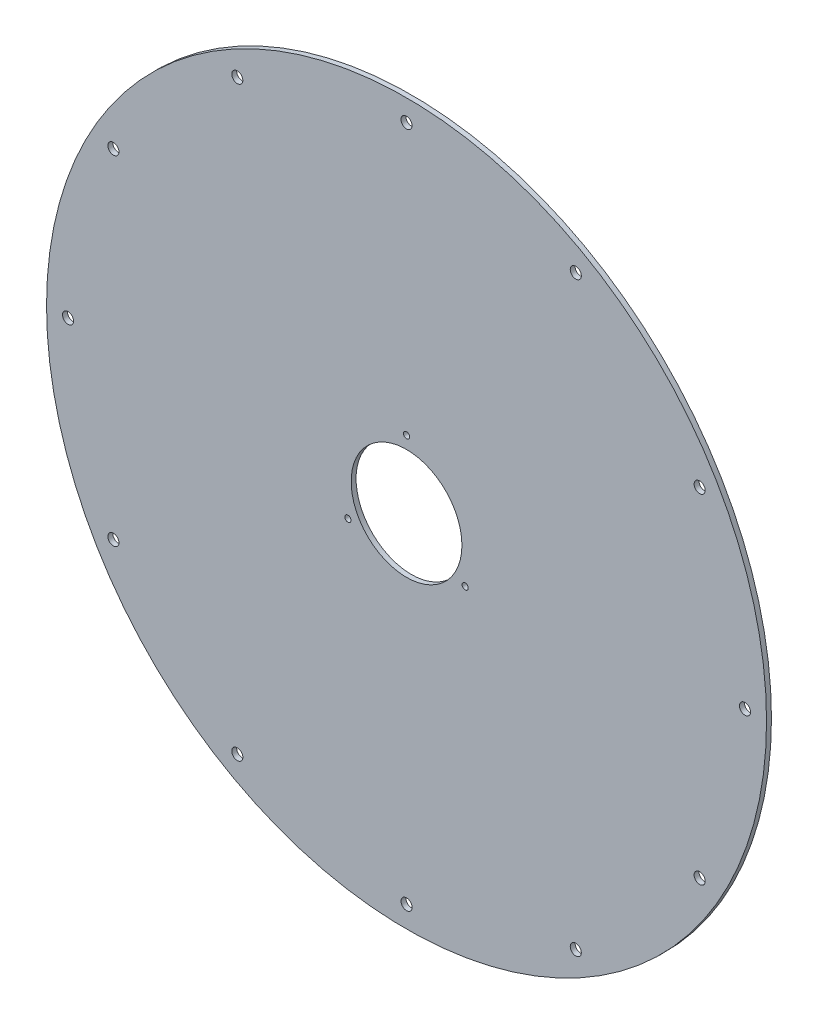
from build123d import *

# Parameters (mm, degrees)
SKETCH1_R           = 292.5
SKETCH1_R_2         = 45
BOSS_EXTRUDE1_DEPTH = 4
SKETCH2_R           = 4.5
CUT_EXTRUDE1_DEPTH  = 414.676806215
CIRPATTERN1_COUNT   = 12
CIRPATTERN3_COUNT   = 3


with BuildPart() as part:
    # Sketch1 → Boss-Extrude1 (new body)
    with BuildSketch(Plane.XY):
        Circle(SKETCH1_R)
        Circle(SKETCH1_R_2, mode=Mode.SUBTRACT)
    extrude(amount=BOSS_EXTRUDE1_DEPTH)

    # Sketch2 → Cut-Extrude1 (cut, through all)
    with BuildSketch(Plane.XY.offset(4)):
        with Locations((0, 275)):
            Circle(SKETCH2_R)
    cut_extrude1 = extrude(amount=-CUT_EXTRUDE1_DEPTH, mode=Mode.SUBTRACT)

    # CirPattern1: Cut-Extrude1 ×12 about axis
    cirpattern1_axis = Axis((0, 0, 0), (0, 0, 1))
    for i in range(1, CIRPATTERN1_COUNT):
        add(cut_extrude1.rotate(cirpattern1_axis, i * 360 / CIRPATTERN1_COUNT), mode=Mode.SUBTRACT)

    # Sketch6 → M6x1.0 Tapped Hole1 (revolve, cut)
    with BuildSketch(Plane(origin=(0, 55, 0), x_dir=(0, 1, 0), z_dir=(1, 0, 0))):
        Polygon((0, 0), (0, 16.502151548), (2.5, 15), (2.5, 0), align=None)
    m6x1_0_tapped_hole1 = revolve(axis=Axis((0, 55, -6.35), (0, 0, 1)), mode=Mode.SUBTRACT)

    # CirPattern3: M6x1.0 Tapped Hole1 ×3 about axis
    cirpattern3_axis = Axis((0, 0, 0), (0, 0, 1))
    for i in range(1, CIRPATTERN3_COUNT):
        add(m6x1_0_tapped_hole1.rotate(cirpattern3_axis, i * 360 / CIRPATTERN3_COUNT), mode=Mode.SUBTRACT)


solid = part.part
